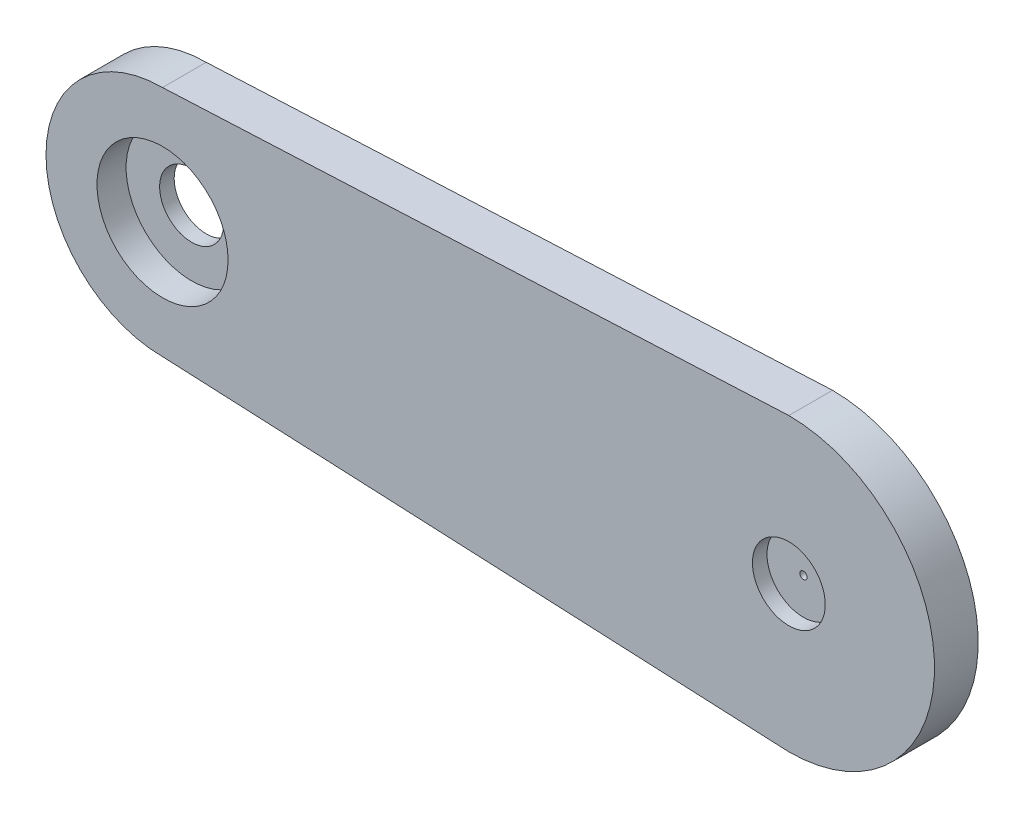
from build123d import *

# Parameters (mm, degrees)
CROQUIS1_R              = 1.25
SALIENTE_EXTRUIR1_DEPTH = 15
CROQUIS5_R              = 11
CORTAR_EXTRUIR1_DEPTH   = 5
CROQUIS6_R              = 12.5
CORTAR_EXTRUIR2_DEPTH   = 5
CROQUIS4_R              = 22.5
CORTAR_EXTRUIR3_DEPTH   = 10


with BuildPart() as part:
    # Croquis1 → Saliente-Extruir1 (new body)
    with BuildSketch(Plane.XY):
        with BuildLine():
            ThreePointArc((0, 40), (-40, 0), (0, -40))
            Line((0, -40), (215, -50))
            ThreePointArc((215, -50), (265, 0), (215, 50))
            Line((215, 50), (0, 40))
        make_face()
        Circle(CROQUIS1_R, mode=Mode.SUBTRACT)
        with Locations((215, 0)):
            Circle(CROQUIS1_R, mode=Mode.SUBTRACT)
    extrude(amount=SALIENTE_EXTRUIR1_DEPTH)

    # Croquis5 → Cortar-Extruir1 (cut)
    with BuildSketch(Plane(origin=(0, 0, 0), x_dir=(-1, 0, 0), z_dir=(0, 0, -1))):
        Circle(CROQUIS5_R)
    extrude(amount=-CORTAR_EXTRUIR1_DEPTH, mode=Mode.SUBTRACT)

    # Croquis6 → Cortar-Extruir2 (cut)
    with BuildSketch(Plane.XY.offset(15)):
        with Locations((215, 0)):
            Circle(CROQUIS6_R)
    extrude(amount=-CORTAR_EXTRUIR2_DEPTH, mode=Mode.SUBTRACT)

    # Croquis4 → Cortar-Extruir3 (cut)
    with BuildSketch(Plane.XY.offset(15)):
        Circle(CROQUIS4_R)
    extrude(amount=-CORTAR_EXTRUIR3_DEPTH, mode=Mode.SUBTRACT)


solid = part.part
